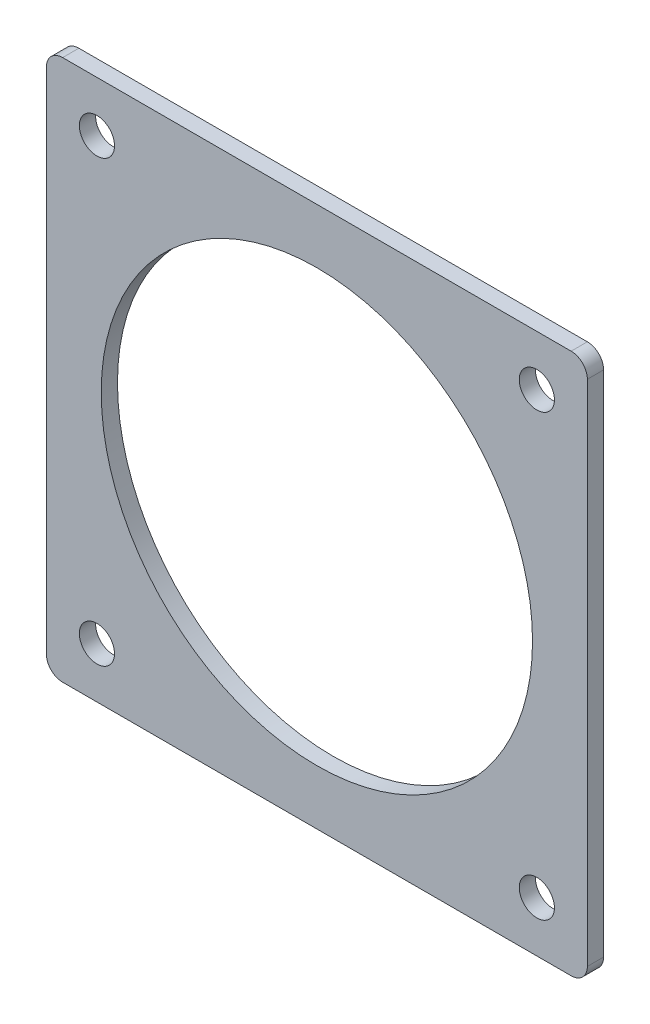
from build123d import *

# Parameters (mm, degrees)
SKETCH1_R           = 39.862662415
SKETCH1_R_2         = 3.25
BOSS_EXTRUDE1_DEPTH = 3


with BuildPart() as part:
    # Sketch1 → Boss-Extrude1 (new body)
    with BuildSketch(Plane.XY):
        with BuildLine():
            Line((-47, 50), (47, 50))
            ThreePointArc((47, 50), (49.121320344, 49.121320344), (50, 47))
            Line((50, 47), (50, -47))
            ThreePointArc((50, -47), (49.121320344, -49.121320344), (47, -50))
            Line((47, -50), (-47, -50))
            ThreePointArc((-47, -50), (-49.121320344, -49.121320344), (-50, -47))
            Line((-50, -47), (-50, 47))
            ThreePointArc((-50, 47), (-49.121320344, 49.121320344), (-47, 50))
        make_face()
        Circle(SKETCH1_R, mode=Mode.SUBTRACT)
        with Locations((40.658639918, 40.658639918)):
            Circle(SKETCH1_R_2, mode=Mode.SUBTRACT)
        with Locations((-40.658639918, 40.658639918)):
            Circle(SKETCH1_R_2, mode=Mode.SUBTRACT)
        with Locations((-40.658639918, -40.658639918)):
            Circle(SKETCH1_R_2, mode=Mode.SUBTRACT)
        with Locations((40.658639918, -40.658639918)):
            Circle(SKETCH1_R_2, mode=Mode.SUBTRACT)
    extrude(amount=BOSS_EXTRUDE1_DEPTH)


solid = part.part
